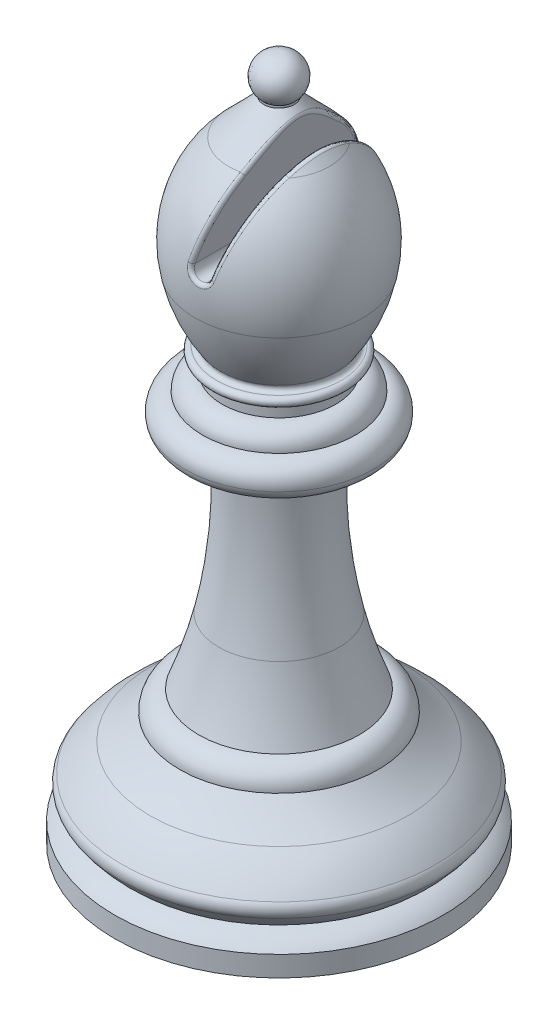
from build123d import *

# Parameters (mm, degrees)
CUT_EXTRUDE1_DEPTH      = 53.384107918
CUT_EXTRUDE1_DEPTH_BACK = 53.384107918
FILLET1_R               = 0.254


with BuildPart() as part:
    # Sketch1 → Revolve1 (revolve)
    with BuildSketch(Plane.XY, mode=Mode.PRIVATE) as revolve1_sk:
        with BuildLine():
            Line((0, 0), (-11.904651473, 0))
            Line((-11.904651473, 0), (-11.904651473, 1.479507642))
            ThreePointArc((-11.904651473, 1.479507642), (-11.262217484, 2.008009101), (-10.494387703, 2.328122596))
            ThreePointArc((-10.494387703, 2.328122596), (-11.007132237, 2.844095481), (-11.455603133, 3.416816032))
            ThreePointArc((-11.455603133, 3.416816032), (-11.595309633, 3.923121391), (-11.389323898, 4.406270331))
            ThreePointArc((-11.389323898, 4.406270331), (-10.444105831, 5.499246879), (-9.333730523, 6.423963918))
            ThreePointArc((-9.333730523, 6.423963918), (-8.220062489, 7.285513328), (-7.189668501, 8.245102879))
            ThreePointArc((-7.189668501, 8.245102879), (-6.801021771, 9.267842688), (-5.811315436, 9.734237768))
            ThreePointArc((-5.811315436, 9.734237768), (-4.994261756, 12.092016375), (-4.358473205, 14.504995776))
            ThreePointArc((-4.358473205, 14.504995776), (-3.53983621, 20.228935206), (-3.615810601, 26.010619823))
            Line((-3.615810601, 26.010619823), (-5.793952193, 26.010619823))
            ThreePointArc((-5.793952193, 26.010619823), (-6.47566179, 26.261739532), (-6.831564249, 26.895081874))
            ThreePointArc((-6.831564249, 26.895081874), (-6.529858332, 27.946056008), (-5.528846423, 28.385997194))
            ThreePointArc((-5.528846423, 28.385997194), (-5.103299033, 29.324400772), (-4.115588424, 29.617862195))
            Line((-4.115588424, 29.617862195), (-4.115588424, 30.567754269))
            ThreePointArc((-4.115588424, 30.567754269), (-4.364062484, 30.605972583), (-4.609978163, 30.658178681))
            ThreePointArc((-4.609978163, 30.658178681), (-4.858832649, 31.028450025), (-4.511764059, 31.308758457))
            ThreePointArc((-4.511764059, 31.308758457), (-4.24339289, 31.453849611), (-4.255734912, 31.758681042))
            ThreePointArc((-4.255734912, 31.758681042), (-5.368795777, 33.791744616), (-6.067360694, 36.001780598))
            ThreePointArc((-6.067360694, 36.001780598), (-5.901604761, 40.453232452), (-3.652758768, 44.298436002))
            Line((-3.652758768, 44.298436002), (-1.09999875, 46.903842006))
            Line((-1.09999875, 46.903842006), (-1.09999875, 47.06224986))
            ThreePointArc((-1.09999875, 47.06224986), (-1.476280508, 48.731819057), (0, 49.59763955))
            Line((0, 49.59763955), (0, 0))
        make_face()
    revolve(revolve1_sk.sketch.rotate(Axis((0, 49.59763955, 0), (0, -1, 0)), 270), axis=Axis((0, 49.59763955, 0), (0, -1, 0)))

    # Sketch2 → Cut-Extrude1 (cut, two sides: drawn at the far end of the back side and taken through both)
    with BuildSketch(Plane.XY.offset(-CUT_EXTRUDE1_DEPTH_BACK)):
        with BuildLine():
            Line((-0.180999949, 39.252332647), (1.972148726, 48.177932855))
            Line((1.972148726, 48.177932855), (3.521197341, 47.717139913))
            Line((3.521197341, 47.717139913), (1.058280361, 38.953377428))
            ThreePointArc((1.058280361, 38.953377428), (0.289162597, 38.483214882), (-0.180999949, 39.252332647))
        make_face()
    extrude(amount=CUT_EXTRUDE1_DEPTH + CUT_EXTRUDE1_DEPTH_BACK, mode=Mode.SUBTRACT)

    # Fillet1
    fillet1_edges = [part.edges().sort_by_distance(p)[0] for p in [
        (1.553211495, 46.441282581, 1.374e-06),
        (2.803902171, 45.164798706, 0),
    ]]
    fillet(fillet1_edges, radius=FILLET1_R)


solid = part.part
